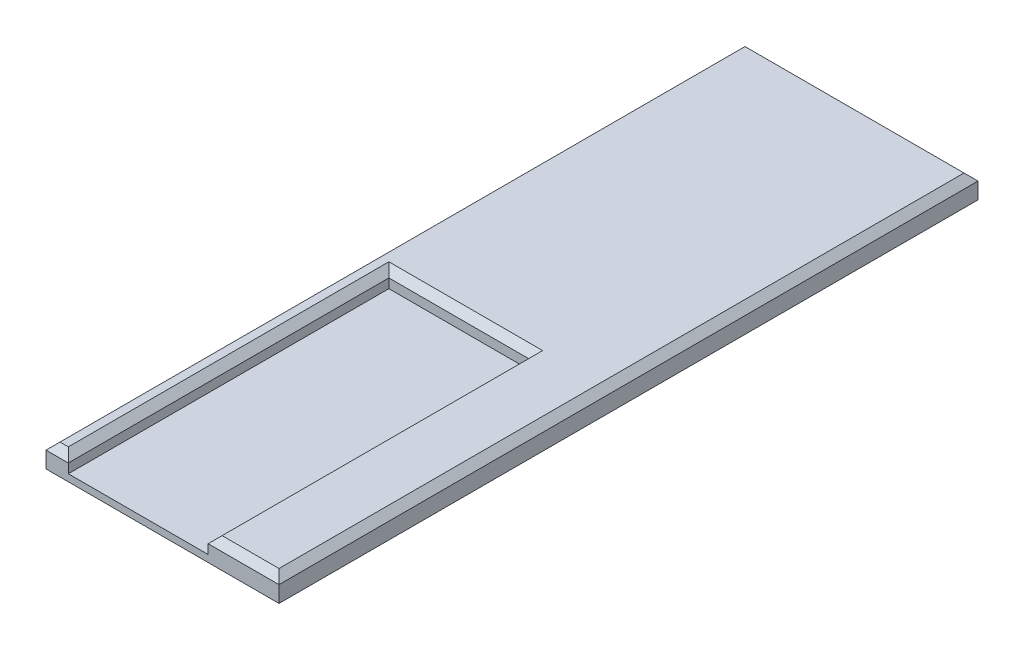
from build123d import *

# Parameters (mm, degrees)
SKETCH1_W           = 100
SKETCH1_H           = 300
BOSS_EXTRUDE1_DEPTH = 10
SKETCH2_W           = 60
SKETCH2_H           = 137.571747247
CUT_EXTRUDE1_DEPTH  = 7
CHAMFER1_SIZE       = 3


with BuildPart() as part:
    # Sketch1 → Boss-Extrude1 (new body)
    with BuildSketch(Plane(origin=(0, 0, 0), x_dir=(1, 0, 0), z_dir=(0, 1, 0))):
        Rectangle(SKETCH1_W, SKETCH1_H)
    extrude(amount=-BOSS_EXTRUDE1_DEPTH)

    # Sketch2 → Cut-Extrude1 (cut)
    with BuildSketch(Plane(origin=(0, 0, 0), x_dir=(1, 0, 0), z_dir=(0, 1, 0))):
        with Locations((-10.417468157, -81.214126377)):
            Rectangle(SKETCH2_W, SKETCH2_H)
    extrude(amount=-CUT_EXTRUDE1_DEPTH, mode=Mode.SUBTRACT)

    # Chamfer1
    chamfer1_edges = [part.edges().sort_by_distance(p)[0] for p in [
        (34.791265922, 0, 150),
        (19.582531843, 0, 81.214126377),
        (-10.417468157, 0, 12.428252753),
        (-40.417468157, 0, 81.214126377),
        (0, 0, -150),
        (50, 0, 0),
        (-45.208734078, 0, 150),
        (-50, 0, 0),
    ]]
    chamfer(chamfer1_edges, length=CHAMFER1_SIZE)


solid = part.part
